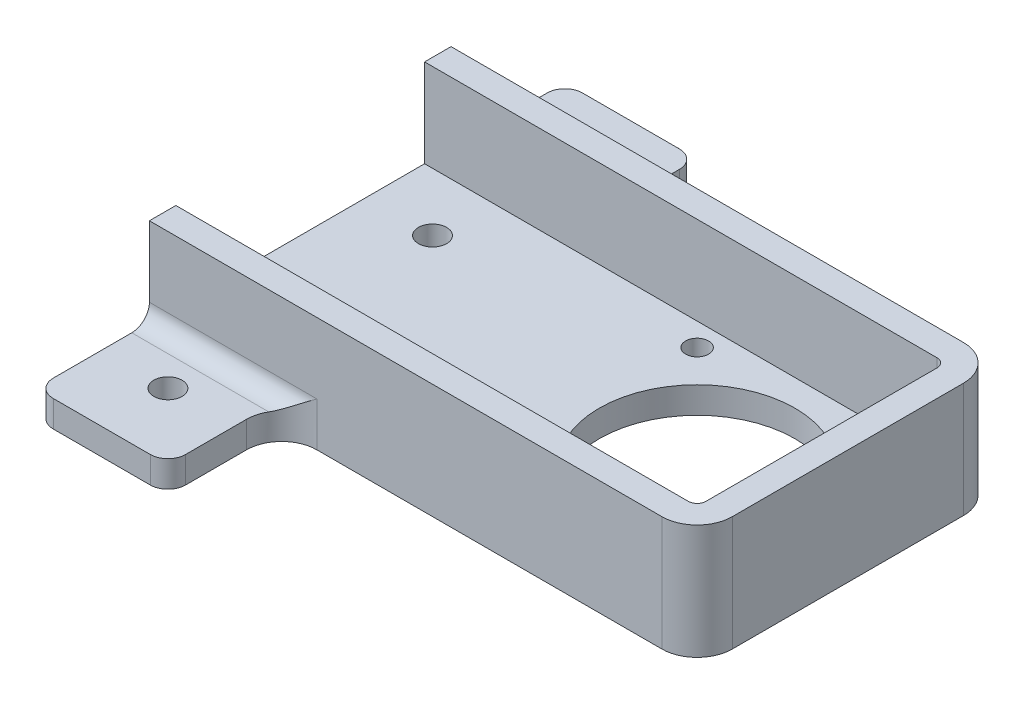
from build123d import *

# Parameters (mm, degrees)
BOSS_EXTRUDE1_DEPTH = 3
SKETCH2_R           = 1.6
CUT_EXTRUDE1_DEPTH  = 87.402604127
BOSS_EXTRUDE2_DEPTH = 10
CUT_EXTRUDE2_REACH  = 88.928
SKETCH5_R           = 11.1
CUT_EXTRUDE3_REACH  = 88.928
SKETCH6_R           = 1.3
FILLET1_R           = 1
FILLET2_R           = 4
FILLET3_R           = 4
FILLET4_R           = 2
FILLET5_R           = 2


with BuildPart() as part:
    # Sketch1 → Boss-Extrude1 (new body)
    with BuildSketch(Plane(origin=(0, 0, 0), x_dir=(1, 0, 0), z_dir=(0, 1, 0))):
        Polygon((0, 0), (15, 0), (15, 12.9), (62.1, 12.9), (62.1, 47.1), (15, 47.1), (15, 60), (0, 60), align=None)
    extrude(amount=BOSS_EXTRUDE1_DEPTH)

    # Sketch2 → Cut-Extrude1 (cut, through all)
    with BuildSketch(Plane(origin=(0, 3, 0), x_dir=(1, 0, 0), z_dir=(0, 1, 0))):
        with Locations(Location((7.5, 52.5, 0), (0, 0, 270))):
            Circle(SKETCH2_R)
        with Locations(Location((7.5, 37.5, 0), (0, 0, 270))):
            Circle(SKETCH2_R)
        with Locations(Location((7.5, 7.5, 0), (0, 0, 270))):
            Circle(SKETCH2_R)
        with Locations(Location((7.5, 22.5, 0), (0, 0, 270))):
            Circle(SKETCH2_R)
    extrude(amount=-CUT_EXTRUDE1_DEPTH, mode=Mode.SUBTRACT)

    # Sketch3 → Boss-Extrude2 (add)
    with BuildSketch(Plane(origin=(0, 3, 0), x_dir=(1, 0, 0), z_dir=(0, 1, 0))):
        Polygon((62.1, 12.9), (15, 12.9), (0, 12.9), (0, 15.9), (59.1, 15.9), (59.1, 44.1), (0, 44.1), (0, 47.1), (62.1, 47.1), align=None)
    extrude(amount=BOSS_EXTRUDE2_DEPTH)

    # Sketch5 → Cut-Extrude2 (cut, up to next)
    with BuildSketch(Plane(origin=(0, 3, 0), x_dir=(1, 0, 0), z_dir=(0, 1, 0)), mode=Mode.PRIVATE) as cut_extrude2_sk1:
        with Locations(Location((45, 30, 0), (0, 0, 270))):
            Circle(SKETCH5_R)
    cut_extrude2_tool1 = extrude(cut_extrude2_sk1.sketch, amount=-CUT_EXTRUDE2_REACH, mode=Mode.PRIVATE) & part.part
    add(cut_extrude2_tool1.solids().sort_by_distance((45, 3, -30))[0], mode=Mode.SUBTRACT)

    # Sketch6 → Cut-Extrude3 (cut, up to next)
    with BuildSketch(Plane(origin=(0, 3, 0), x_dir=(1, 0, 0), z_dir=(0, 1, 0)), mode=Mode.PRIVATE) as cut_extrude3_sk1:
        with Locations(Location((56.5, 41.5, 0), (0, 0, 270))):
            Circle(SKETCH6_R)
    cut_extrude3_tool1 = extrude(cut_extrude3_sk1.sketch, amount=-CUT_EXTRUDE3_REACH, mode=Mode.PRIVATE) & part.part
    # Sketch6 → Cut-Extrude3 (cut, up to next)
    with BuildSketch(Plane(origin=(0, 3, 0), x_dir=(1, 0, 0), z_dir=(0, 1, 0)), mode=Mode.PRIVATE) as cut_extrude3_sk2:
        with Locations(Location((33.5, 41.5, 0), (0, 0, 270))):
            Circle(SKETCH6_R)
    cut_extrude3_tool2 = extrude(cut_extrude3_sk2.sketch, amount=-CUT_EXTRUDE3_REACH, mode=Mode.PRIVATE) & part.part
    # Sketch6 → Cut-Extrude3 (cut, up to next)
    with BuildSketch(Plane(origin=(0, 3, 0), x_dir=(1, 0, 0), z_dir=(0, 1, 0)), mode=Mode.PRIVATE) as cut_extrude3_sk3:
        with Locations(Location((33.5, 18.5, 0), (0, 0, 270))):
            Circle(SKETCH6_R)
    cut_extrude3_tool3 = extrude(cut_extrude3_sk3.sketch, amount=-CUT_EXTRUDE3_REACH, mode=Mode.PRIVATE) & part.part
    # Sketch6 → Cut-Extrude3 (cut, up to next)
    with BuildSketch(Plane(origin=(0, 3, 0), x_dir=(1, 0, 0), z_dir=(0, 1, 0)), mode=Mode.PRIVATE) as cut_extrude3_sk4:
        with Locations(Location((56.5, 18.5, 0), (0, 0, 270))):
            Circle(SKETCH6_R)
    cut_extrude3_tool4 = extrude(cut_extrude3_sk4.sketch, amount=-CUT_EXTRUDE3_REACH, mode=Mode.PRIVATE) & part.part
    add(cut_extrude3_tool1.solids().sort_by_distance((56.5, 3, -41.5))[0], mode=Mode.SUBTRACT)
    add(cut_extrude3_tool2.solids().sort_by_distance((33.5, 3, -41.5))[0], mode=Mode.SUBTRACT)
    add(cut_extrude3_tool3.solids().sort_by_distance((33.5, 3, -18.5))[0], mode=Mode.SUBTRACT)
    add(cut_extrude3_tool4.solids().sort_by_distance((56.5, 3, -18.5))[0], mode=Mode.SUBTRACT)

    # Fillet1
    fillet1_edges = [part.edges().sort_by_distance(p)[0] for p in [
        (59.1, 8, -44.1),
        (59.1, 8, -15.9),
    ]]
    fillet(fillet1_edges, radius=FILLET1_R)

    # Fillet2
    fillet2_edges = [part.edges().sort_by_distance(p)[0] for p in [
        (62.1, 6.5, -47.1),
        (62.1, 6.5, -12.9),
    ]]
    fillet(fillet2_edges, radius=FILLET2_R)

    # Fillet3
    fillet3_edges = [part.edges().sort_by_distance(p)[0] for p in [
        (15, 1.5, -47.1),
        (15, 1.5, -12.9),
    ]]
    fillet(fillet3_edges, radius=FILLET3_R)

    # Fillet4
    fillet4_edges = [part.edges().sort_by_distance(p)[0] for p in [
        (9.5, 3, -47.1),
        (9.5, 3, -12.9),
    ]]
    fillet(fillet4_edges, radius=FILLET4_R)

    # Fillet5
    fillet5_edges = [part.edges().sort_by_distance(p)[0] for p in [
        (0, 1.5, -60),
        (15, 1.5, -60),
        (15, 1.5, 0),
        (0, 1.5, 0),
    ]]
    fillet(fillet5_edges, radius=FILLET5_R)


solid = part.part
